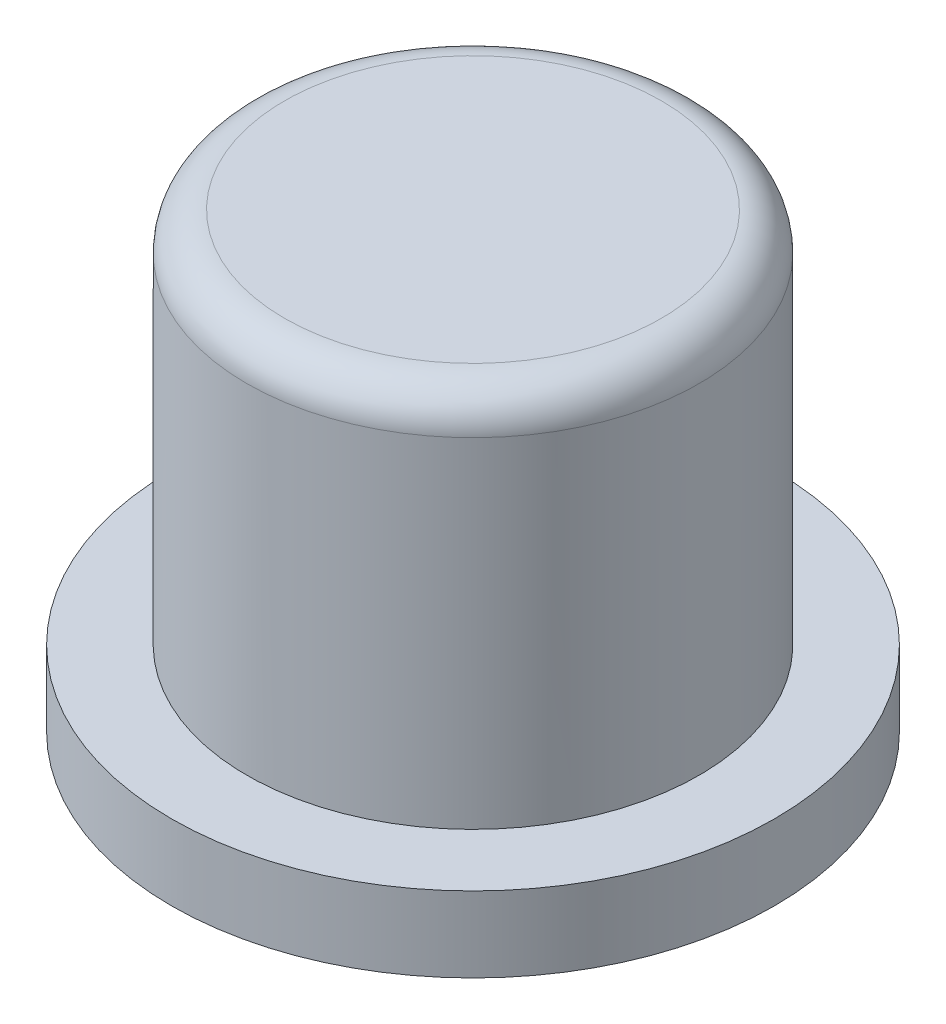
from build123d import *

# Parameters (mm, degrees)
SKETCH1_R           = 38.1
BOSS_EXTRUDE1_DEPTH = 63.5
SKETCH2_R           = 50.8
BOSS_EXTRUDE2_DEPTH = 12.7
FILLET1_R           = 6.35


with BuildPart() as part:
    # Sketch1 → Boss-Extrude1 (new body)
    with BuildSketch(Plane(origin=(0, 0, 0), x_dir=(1, 0, 0), z_dir=(0, 1, 0))):
        with Locations(Location((0, 0, 0), (0, 0, 270))):
            Circle(SKETCH1_R)
    extrude(amount=BOSS_EXTRUDE1_DEPTH)

    # Sketch2 → Boss-Extrude2 (add)
    with BuildSketch(Plane.XZ):
        with Locations(Location((0, 0, 0), (0, 0, 270))):
            Circle(SKETCH2_R)
    extrude(amount=BOSS_EXTRUDE2_DEPTH)

    # Fillet1
    fillet1_edges = [part.edges().sort_by_distance(p)[0] for p in [
        (0, 63.5, -38.1),
    ]]
    fillet(fillet1_edges, radius=FILLET1_R)


solid = part.part
